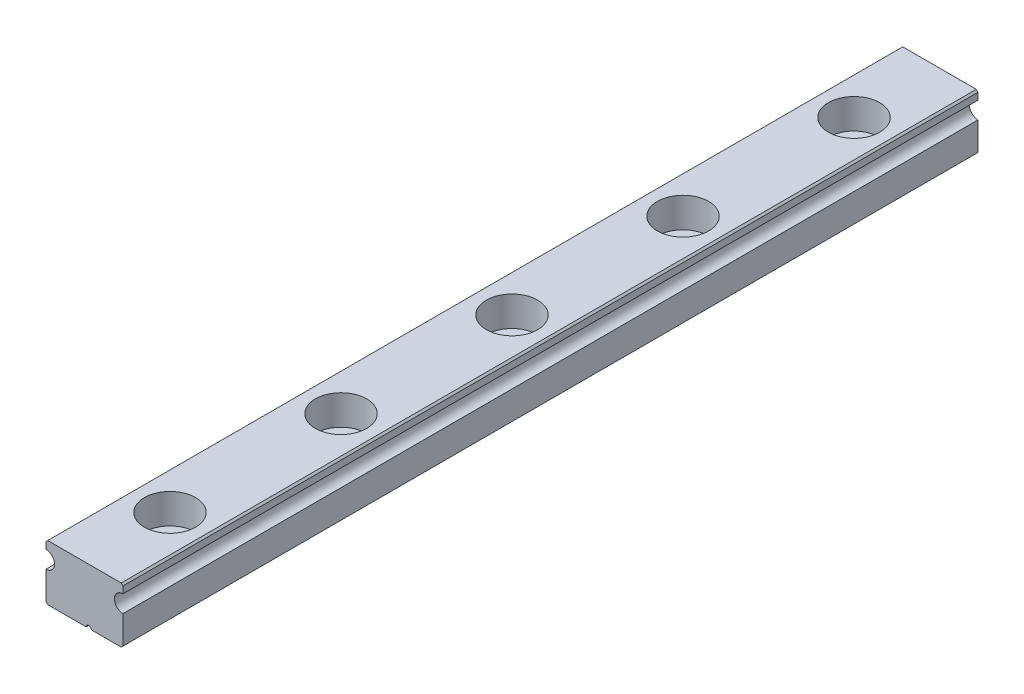
from build123d import *

# Parameters (mm, degrees)
EXTRUDE_1_DEPTH              = 220
HOLE_WIZARD_M3_1_D           = 3.5
HOLE_WIZARD_M3_1_CBORE_D     = 6
HOLE_WIZARD_M3_1_CBORE_DEPTH = 3.5
PATTERN_LINEAR_1_COUNT       = 11
PATTERN_LINEAR_1_PITCH       = 20
SKETCH_6_W                   = 1.5
SKETCH_6_H                   = 0.134615385
CUT_EXTRUDE_1_DEPTH          = 0.1
SKETCH_8_W                   = 50
SKETCH_8_H                   = 60
SKETCH_8_H_2                 = 140
CUT_EXTRUDE_2_DEPTH          = 221.14199973


with BuildPart() as part:
    # 草图1 → 凸台-拉伸1 (new body)
    with BuildSketch(Plane.XY):
        with BuildLine():
            Line((4.5, 5.5), (4.5, 6.3))
            Line((4.5, 6.3), (4.3, 6.5))
            Line((4.3, 6.5), (-4.3, 6.5))
            Line((-4.3, 6.5), (-4.5, 6.3))
            Line((-4.5, 6.3), (-4.5, 5.5))
            ThreePointArc((-4.5, 5.5), (-3.5, 4.5), (-4.5, 3.5))
            Line((-4.5, 3.5), (-4.5, 0.2))
            Line((-4.5, 0.2), (-4.3, 0))
            Line((-4.3, 0), (0.2, 0))
            ThreePointArc((0.2, 0), (0.5, 0.3), (0.8, 0))
            Line((0.8, 0), (4.3, 0))
            Line((4.3, 0), (4.5, 0.2))
            Line((4.5, 0.2), (4.5, 3.5))
            ThreePointArc((4.5, 3.5), (3.5, 4.5), (4.5, 5.5))
        make_face()
    extrude(amount=-EXTRUDE_1_DEPTH)

    # M3 六角凹头螺钉的柱形沉头孔1 (through all)
    with Locations(Plane(origin=(0.754900713, 6.5, 19.343475793), x_dir=(-1, 0, 0), z_dir=(0, 1, 0))):
        with Locations((0.754900713, -29.343475793)):
            hole_wizard_m3_1 = CounterBoreHole(HOLE_WIZARD_M3_1_D / 2, HOLE_WIZARD_M3_1_CBORE_D / 2, HOLE_WIZARD_M3_1_CBORE_DEPTH)

    # 阵列(线性)1: M3 六角凹头螺钉的柱形沉头孔1 ×11
    with Locations(*[(0, 0, -i * PATTERN_LINEAR_1_PITCH) for i in range(1, PATTERN_LINEAR_1_COUNT)]):
        add(hole_wizard_m3_1, mode=Mode.SUBTRACT)

    # 草图6 → 切除-拉伸1 (cut)
    # profile 1 of 9: a face of its own
    with BuildSketch(Plane(origin=(0, 6.5, 0), x_dir=(1, 0, 0), z_dir=(0, 1, 0))):
        Polygon((-1.5, 13.740384615), (-1.5, 13.875), (-0.884615385, 13.875), (-0.884615385, 14.644230769), (-1.5, 14.644230769), (-1.5, 14.778846154), (0, 14.778846154), (0, 14.644230769), (-0.730769231, 14.644230769), (-0.730769231, 13.875), (0, 13.875), (0, 13.740384615), align=None)
    # profile 2 of 9: a face of its own
    with BuildSketch(Plane(origin=(0, 6.5, 0), x_dir=(1, 0, 0), z_dir=(0, 1, 0))):
        with Locations((-0.75, 15.230769231)):
            Rectangle(SKETCH_6_W, SKETCH_6_H)
    # profile 3 of 9: a face of its own
    with BuildSketch(Plane(origin=(0, 6.5, 0), x_dir=(1, 0, 0), z_dir=(0, 1, 0))):
        Polygon((-1.5, 15.528846154), (-1.5, 15.66796875), (-0.399939904, 15.961538462), (-1.5, 16.398137019), (-1.5, 16.417668269), (-0.407451923, 16.846153846), (-1.5, 17.141225962), (-1.5, 17.278846154), (0, 16.874399038), (0, 16.855168269), (-1.147235577, 16.403846154), (0, 15.947115385), (0, 15.927884615), align=None)
    # profile 4 of 9: a face of its own
    with BuildSketch(Plane(origin=(0, 6.5, 0), x_dir=(1, 0, 0), z_dir=(0, 1, 0))):
        with Locations((-0.75, 17.692307693)):
            Rectangle(SKETCH_6_W, SKETCH_6_H)
    # profile 5 of 9: a face of its own
    with BuildSketch(Plane(origin=(0, 6.5, 0), x_dir=(1, 0, 0), z_dir=(0, 1, 0))):
        Polygon((0, 18.086538462), (-1.5, 18.086538462), (-1.5, 18.114783654), (-0.319411058, 19.105769231), (-1.5, 19.105769231), (-1.5, 19.240384615), (0, 19.240384615), (0, 19.209735577), (-1.177884615, 18.221153846), (0, 18.221153846), align=None)
    # profile 6 of 9: a face of its own
    with BuildSketch(Plane(origin=(0, 6.5, 0), x_dir=(1, 0, 0), z_dir=(0, 1, 0))):
        Polygon((0, 20.125), (-1.5, 20.323016827), (-1.5, 20.342247596), (-0.269230769, 20.961538462), (-1.5, 21.579326923), (-1.5, 21.598858173), (0, 21.798076923), (0, 21.662860577), (-1.079326923, 21.519230769), (0, 20.977764423), (0, 20.947415865), (-1.081730769, 20.403846154), (0, 20.260516827), align=None)
    # profile 7 of 9: a face of its own
    with BuildSketch(Plane(origin=(0, 6.5, 0), x_dir=(1, 0, 0), z_dir=(0, 1, 0))):
        with BuildLine():
            Line((-1.243990385, 23.509615385), (-1.134615385, 23.394230769))
            add(Edge.make_bspline(
                [(-1.134615385, 23.394230769), (-1.154263766, 23.373355449), (-1.193092001, 23.332102593), (-1.243390317, 23.264731189), (-1.28690443, 23.194721537), (-1.322045397, 23.121960438), (-1.349611823, 23.048355866), (-1.369650093, 22.975173457), (-1.382340162, 22.902887044), (-1.383864341, 22.854816629), (-1.384615385, 22.831129808)],
                knots=[0, 0, 0, 0, 1.089067066, 2.152164705, 3.18986567, 4.218445106, 5.218487318, 6.173592265, 7.100032889, 8, 8, 8, 8], degree=3))
            add(Edge.make_bspline(
                [(-1.384615385, 22.831129808), (-1.384438125, 22.816594936), (-1.384084065, 22.78756289), (-1.379565116, 22.7444392), (-1.373065889, 22.701767784), (-1.363662227, 22.659629195), (-1.351744059, 22.6179415), (-1.336836002, 22.576849691), (-1.319455188, 22.536277104), (-1.299371251, 22.496605953), (-1.277308532, 22.458145638), (-1.252858892, 22.42182164), (-1.226807524, 22.387400299), (-1.198496406, 22.355536353), (-1.168203133, 22.326017847), (-1.136473262, 22.298301833), (-1.102682945, 22.272904871), (-1.066971137, 22.250282454), (-1.030168657, 22.229853485), (-0.992587626, 22.212199685), (-0.954576919, 22.196852561), (-0.915850319, 22.185163721), (-0.876807084, 22.175263346), (-0.837242608, 22.168371388), (-0.797053572, 22.164472967), (-0.770140273, 22.163799899), (-0.756610577, 22.163461538)],
                knots=[0, 0, 0, 0, 1.028150113, 2.053633673, 3.06513288, 4.081487945, 5.106702018, 6.131327874, 7.172780699, 8.228344599, 9.276313556, 10.308389736, 11.324843658, 12.329040066, 13.321460474, 14.316307835, 15.308626991, 16.309440696, 17.305625405, 18.28535951, 19.246194545, 20.203493668, 21.145557131, 22.095268976, 23.042464743, 24, 24, 24, 24], degree=3))
            add(Edge.make_bspline(
                [(-0.756610577, 22.163461538), (-0.742780294, 22.163785622), (-0.715157493, 22.164432905), (-0.673930463, 22.168569989), (-0.633320499, 22.176265079), (-0.593263727, 22.186470115), (-0.553680426, 22.199444118), (-0.514611904, 22.215383767), (-0.476061961, 22.23437211), (-0.438413282, 22.256302653), (-0.401770368, 22.280520997), (-0.36696502, 22.307157219), (-0.334402283, 22.336256163), (-0.303606537, 22.367284281), (-0.274772132, 22.40052428), (-0.248246624, 22.43629865), (-0.223619847, 22.474106619), (-0.201162346, 22.513964957), (-0.181102046, 22.555452377), (-0.163263098, 22.597990847), (-0.14857199, 22.641717091), (-0.136598507, 22.686401091), (-0.126784097, 22.731989638), (-0.120470176, 22.778714125), (-0.115888391, 22.826231), (-0.11555339, 22.858261842), (-0.115384615, 22.874399038)],
                knots=[0, 0, 0, 0, 0.935915162, 1.869274651, 2.799799983, 3.730201895, 4.664668062, 5.616159355, 6.583070886, 7.570012957, 8.562524459, 9.553461134, 10.53281078, 11.515274572, 12.509912756, 13.507571325, 14.526460018, 15.561318395, 16.601025881, 17.643204557, 18.680545676, 19.719612342, 20.772381578, 21.833430283, 22.908478249, 24, 24, 24, 24], degree=3))
            add(Edge.make_bspline(
                [(-0.115384615, 22.874399038), (-0.11579098, 22.893846981), (-0.116588941, 22.932036175), (-0.122805743, 22.988172098), (-0.132502802, 23.042091792), (-0.14674811, 23.093619722), (-0.164779159, 23.142942891), (-0.187077122, 23.189879386), (-0.213407387, 23.234558812), (-0.24323677, 23.276787781), (-0.276471827, 23.315562361), (-0.312015273, 23.350851823), (-0.350327601, 23.381442662), (-0.390837822, 23.408248655), (-0.433933425, 23.430404616), (-0.479374666, 23.448595707), (-0.527189663, 23.462538188), (-0.560228886, 23.468261798), (-0.576923077, 23.471153846)],
                knots=[0, 0, 0, 0, 1.130199668, 2.219330667, 3.279027493, 4.311506524, 5.322739849, 6.327972234, 7.327472899, 8.33386792, 9.329086447, 10.29244429, 11.240784345, 12.174119183, 13.111530729, 14.052100829, 15.015757696, 16, 16, 16, 16], degree=3))
            Line((-0.576923077, 23.471153846), (-0.576923077, 22.971153846))
            Line((-0.576923077, 22.971153846), (-0.730769231, 22.971153846))
            Line((-0.730769231, 22.971153846), (-0.730769231, 23.605769231))
            add(Edge.make_bspline(
                [(-0.730769231, 23.605769231), (-0.702094593, 23.605038153), (-0.645973146, 23.603607301), (-0.564128744, 23.593570623), (-0.48682659, 23.577363547), (-0.413985274, 23.555223413), (-0.34570802, 23.526562579), (-0.281925506, 23.491688638), (-0.223049785, 23.450043443), (-0.168600212, 23.403110397), (-0.12003055, 23.350438986), (-0.077342291, 23.293452435), (-0.041384027, 23.232056591), (-0.012129457, 23.166309531), (0.010702255, 23.096426488), (0.026890073, 23.022245754), (0.036588629, 22.943867925), (0.037827792, 22.890152206), (0.038461538, 22.862680288)],
                knots=[0, 0, 0, 0, 1.140356446, 2.231883559, 3.274166699, 4.278491846, 5.25512956, 6.21435461, 7.1637429, 8.11826594, 9.068280886, 10.0076534, 10.945064095, 11.891975133, 12.864533718, 13.863980011, 14.907571808, 16, 16, 16, 16], degree=3))
            add(Edge.make_bspline(
                [(0.038461538, 22.862680288), (0.038217629, 22.845747373), (0.037736562, 22.812350207), (0.034317699, 22.763025524), (0.029054595, 22.715060829), (0.021106685, 22.668463111), (0.011371833, 22.623060964), (-0.001093904, 22.579081142), (-0.015523346, 22.53635611), (-0.031935778, 22.494819831), (-0.050952202, 22.45484931), (-0.072084905, 22.416266517), (-0.095224917, 22.378858178), (-0.120772422, 22.342879107), (-0.148536333, 22.308141841), (-0.178572299, 22.274870365), (-0.210788493, 22.242878417), (-0.233665211, 22.222838219), (-0.245192308, 22.212740385)],
                knots=[0, 0, 0, 0, 1.107784379, 2.184907829, 3.233506516, 4.263428166, 5.276301166, 6.270063455, 7.25232949, 8.225834625, 9.190232166, 10.146266622, 11.1027726, 12.066435141, 13.031522626, 14.010570082, 14.99756817, 16, 16, 16, 16], degree=3))
            add(Edge.make_bspline(
                [(-0.245192308, 22.212740385), (-0.26347973, 22.198089271), (-0.299751023, 22.169030237), (-0.357865285, 22.131625313), (-0.418037511, 22.099738997), (-0.480435209, 22.073867073), (-0.545000015, 22.053665036), (-0.611649425, 22.039176642), (-0.680469267, 22.030687804), (-0.727040094, 22.02946486), (-0.750600962, 22.028846154)],
                knots=[0, 0, 0, 0, 1.023165419, 2.029347347, 3.013907458, 3.994755782, 4.975994455, 5.96558838, 6.970761222, 8, 8, 8, 8], degree=3))
            add(Edge.make_bspline(
                [(-0.750600962, 22.028846154), (-0.768243641, 22.029074256), (-0.803304773, 22.029527561), (-0.855357904, 22.035024211), (-0.906486775, 22.042910531), (-0.956649576, 22.054502135), (-1.005879862, 22.069114786), (-1.054200296, 22.087352121), (-1.101640133, 22.108585168), (-1.147870041, 22.133266476), (-1.192287019, 22.160724506), (-1.234673706, 22.190556358), (-1.274343142, 22.222992223), (-1.311387223, 22.258126549), (-1.346354989, 22.295251091), (-1.378516018, 22.33514522), (-1.408373576, 22.377204507), (-1.435353952, 22.421754996), (-1.459597318, 22.468093695), (-1.480849352, 22.516119874), (-1.498413761, 22.565816082), (-1.513316774, 22.616810749), (-1.524337558, 22.669489669), (-1.532329875, 22.723470616), (-1.537798704, 22.779034949), (-1.538238528, 22.816593247), (-1.538461538, 22.835637019)],
                knots=[0, 0, 0, 0, 1.00895651, 2.005089799, 2.991467152, 3.967318338, 4.948153826, 5.927364234, 6.919980553, 7.91976625, 8.923240147, 9.905815003, 10.88314567, 11.851989312, 12.825009789, 13.798721852, 14.781296708, 15.773896486, 16.776076962, 17.771600213, 18.775744723, 19.78957137, 20.808953803, 21.851964491, 22.910847925, 24, 24, 24, 24], degree=3))
            add(Edge.make_bspline(
                [(-1.538461538, 22.835637019), (-1.538213185, 22.851167695), (-1.537720729, 22.8819632), (-1.534307308, 22.927788514), (-1.528897073, 22.97290552), (-1.521514165, 23.017381116), (-1.511458298, 23.061063844), (-1.499424747, 23.104078147), (-1.485413966, 23.146486377), (-1.46870446, 23.188155626), (-1.449738621, 23.229366076), (-1.428390011, 23.270346865), (-1.404293581, 23.31095797), (-1.37737778, 23.351269819), (-1.348104887, 23.391536616), (-1.315637676, 23.431121462), (-1.281256495, 23.470979867), (-1.256535559, 23.496609216), (-1.243990385, 23.509615385)],
                knots=[0, 0, 0, 0, 0.985871117, 1.954866573, 2.915460327, 3.869826059, 4.81536089, 5.759505086, 6.70452669, 7.649098992, 8.607881297, 9.583363685, 10.581137262, 11.603961102, 12.659522466, 13.73993555, 14.853081303, 16, 16, 16, 16], degree=3))
        make_face()
    # profile 8 of 9: a face of its own
    with BuildSketch(Plane(origin=(0, 6.5, 0), x_dir=(1, 0, 0), z_dir=(0, 1, 0))):
        Polygon((0, 23.913461538), (-1.5, 23.913461538), (-1.5, 23.941706731), (-0.319411058, 24.932692308), (-1.5, 24.932692308), (-1.5, 25.067307692), (0, 25.067307692), (0, 25.036658654), (-1.177884615, 24.048076923), (0, 24.048076923), align=None)
    # profile 9 of 9: a face of its own
    with BuildSketch(Plane(origin=(0, 6.5, 0), x_dir=(1, 0, 0), z_dir=(0, 1, 0))):
        with BuildLine():
            Line((0.038461538, 25.644230769), (-0.036358173, 25.536658654))
            Line((-0.036358173, 25.536658654), (-0.646033654, 25.953725962))
            add(Edge.make_bspline(
                [(-0.646033654, 25.953725962), (-0.642627639, 25.927119325), (-0.635922786, 25.874743285), (-0.635046516, 25.821948826), (-0.634615385, 25.795973558)],
                knots=[0, 0, 0, 0, 1.015985029, 2, 2, 2, 2], degree=3))
            add(Edge.make_bspline(
                [(-0.634615385, 25.795973558), (-0.635018703, 25.780226966), (-0.635810382, 25.749317783), (-0.642085443, 25.703875646), (-0.651749784, 25.660210407), (-0.666170676, 25.61843782), (-0.684092777, 25.578400913), (-0.706317169, 25.540186946), (-0.732462883, 25.503847908), (-0.762390698, 25.469771994), (-0.79525498, 25.438786105), (-0.830027824, 25.411158608), (-0.867084601, 25.38832306), (-0.905643777, 25.369014905), (-0.946528356, 25.354782526), (-0.989044603, 25.344167996), (-1.033456433, 25.33770465), (-1.063680548, 25.336931181), (-1.079026442, 25.336538462)],
                knots=[0, 0, 0, 0, 1.060698949, 2.082059282, 3.085738422, 4.069684654, 5.054463875, 6.037298355, 7.043153692, 8.066652628, 9.088369706, 10.083456696, 11.053578809, 12.016466116, 12.983507685, 13.964045196, 14.966270913, 16, 16, 16, 16], degree=3))
            add(Edge.make_bspline(
                [(-1.079026442, 25.336538462), (-1.100012199, 25.337283285), (-1.141202981, 25.338745222), (-1.201400397, 25.350466182), (-1.258351131, 25.369885651), (-1.3119915, 25.396537862), (-1.361089385, 25.43075081), (-1.405478439, 25.47138122), (-1.444366827, 25.518757479), (-1.477757084, 25.571642671), (-1.504794475, 25.628718475), (-1.524003389, 25.688742519), (-1.536274492, 25.750703662), (-1.537729379, 25.792811829), (-1.538461538, 25.814002404)],
                knots=[0, 0, 0, 0, 1.023011052, 2.007963168, 2.978169221, 3.950402619, 4.919353283, 5.887490769, 6.876420893, 7.899700203, 8.931203047, 9.947778163, 10.96723692, 12, 12, 12, 12], degree=3))
            add(Edge.make_bspline(
                [(-1.538461538, 25.814002404), (-1.537677179, 25.834783148), (-1.536127357, 25.875843941), (-1.524777147, 25.936225043), (-1.505646911, 25.994056533), (-1.479211547, 26.04902008), (-1.446070758, 26.099903164), (-1.406596454, 26.145683388), (-1.360755672, 26.185145911), (-1.309807647, 26.21879079), (-1.25472961, 26.245295182), (-1.197347446, 26.264716171), (-1.138006313, 26.276587527), (-1.097810064, 26.2780886), (-1.077524038, 26.278846154)],
                knots=[0, 0, 0, 0, 1.026358223, 2.027987109, 3.023239252, 4.028077889, 5.032770297, 6.015020143, 7.004250571, 8.011656937, 9.02310243, 10.015224881, 10.998334443, 12, 12, 12, 12], degree=3))
            add(Edge.make_bspline(
                [(-1.077524038, 26.278846154), (-1.061777289, 26.278338872), (-1.029838946, 26.277309978), (-0.981399024, 26.270187018), (-0.932048608, 26.257900384), (-0.890237555, 26.244171772), (-0.855599349, 26.230715419), (-0.828157364, 26.218414328), (-0.799474135, 26.204124912), (-0.769432207, 26.188166246), (-0.737992383, 26.170568563), (-0.705372722, 26.150853478), (-0.671525668, 26.129286907), (-0.648704972, 26.113932306), (-0.637019231, 26.106069712)],
                knots=[0, 0, 0, 0, 1.179894106, 2.393120058, 3.660107319, 4.986885617, 5.687958251, 6.443931318, 7.239444731, 8.088894906, 8.992865148, 9.938946712, 10.944601238, 12, 12, 12, 12], degree=3))
            Line((-0.637019231, 26.106069712), (0.038461538, 25.644230769))
        make_face()
        with BuildLine():
            add(Edge.make_bspline(
                [(-0.788461538, 25.820913462), (-0.788788092, 25.832842038), (-0.789423782, 25.856062922), (-0.793275522, 25.890085737), (-0.800155229, 25.922181807), (-0.809870336, 25.952557703), (-0.822177437, 25.981176653), (-0.837175655, 26.008047671), (-0.855193568, 26.032896281), (-0.875446063, 26.05581095), (-0.897641992, 26.076606708), (-0.92142287, 26.094537445), (-0.946049906, 26.110062218), (-0.972027251, 26.122447516), (-0.998929945, 26.132428799), (-1.027147055, 26.139393389), (-1.056483756, 26.143240028), (-1.076411522, 26.143896939), (-1.086538462, 26.144230769)],
                knots=[0, 0, 0, 0, 1.163726718, 2.265380301, 3.334713825, 4.36057981, 5.371541381, 6.368955992, 7.355979581, 8.359691305, 9.348261197, 10.317521986, 11.261029684, 12.183096459, 13.119698615, 14.055740009, 15.011961376, 16, 16, 16, 16], degree=3))
            add(Edge.make_bspline(
                [(-1.086538462, 26.144230769), (-1.096669885, 26.143944046), (-1.116635099, 26.143379024), (-1.146011565, 26.138837612), (-1.174173238, 26.130870253), (-1.201311834, 26.120071794), (-1.227278993, 26.10611642), (-1.252156559, 26.089207568), (-1.27556797, 26.06878977), (-1.297899065, 26.04597379), (-1.318157147, 26.020878942), (-1.336055672, 25.994290795), (-1.351161049, 25.966351386), (-1.363089133, 25.93693608), (-1.37286104, 25.906444325), (-1.379778661, 25.87456046), (-1.383632614, 25.841240421), (-1.384283622, 25.818619358), (-1.384615385, 25.807091346)],
                knots=[0, 0, 0, 0, 0.971910406, 1.91526867, 2.84337505, 3.775008003, 4.712374136, 5.666733183, 6.654995996, 7.688089235, 8.726800303, 9.745078658, 10.75990398, 11.768337501, 12.786615857, 13.829099629, 14.893678693, 16, 16, 16, 16], degree=3))
            add(Edge.make_bspline(
                [(-1.384615385, 25.807091346), (-1.384283077, 25.795663594), (-1.383631091, 25.773242439), (-1.379786064, 25.740218598), (-1.372814047, 25.708550372), (-1.363093561, 25.678147127), (-1.351160136, 25.648732673), (-1.336054875, 25.620794582), (-1.318161301, 25.594200241), (-1.297882935, 25.569129265), (-1.275672102, 25.546272163), (-1.252051947, 25.526199864), (-1.227292163, 25.509252774), (-1.201308356, 25.495316895), (-1.174174163, 25.48451328), (-1.146011315, 25.476547297), (-1.116635164, 25.472005515), (-1.096669907, 25.471440543), (-1.086538462, 25.471153846)],
                knots=[0, 0, 0, 0, 1.099107991, 2.156440826, 3.191784126, 4.212280276, 5.222910149, 6.239945746, 7.260441896, 8.30141526, 9.33675856, 10.320924759, 11.277362386, 12.216770088, 13.150432123, 14.080559904, 15.025972789, 16, 16, 16, 16], degree=3))
            add(Edge.make_bspline(
                [(-1.086538462, 25.471153846), (-1.076403667, 25.471413811), (-1.056415996, 25.471926509), (-1.02704542, 25.476862927), (-0.998901248, 25.485140198), (-0.971743232, 25.496115903), (-0.945922725, 25.510845615), (-0.921305837, 25.528746476), (-0.897389308, 25.549401013), (-0.875515463, 25.573486122), (-0.855096635, 25.599349364), (-0.837288944, 25.627129241), (-0.822356647, 25.656267501), (-0.809834058, 25.686577057), (-0.800253227, 25.718284705), (-0.793288301, 25.751346293), (-0.789460709, 25.785767775), (-0.788797791, 25.809085836), (-0.788461538, 25.820913462)],
                knots=[0, 0, 0, 0, 0.952872936, 1.879239831, 2.791748947, 3.708674669, 4.628500839, 5.580394867, 6.568761142, 7.595635223, 8.636123962, 9.665976811, 10.694276597, 11.712685318, 12.747011694, 13.805940053, 14.887106426, 16, 16, 16, 16], degree=3))
        make_face(mode=Mode.SUBTRACT)
    extrude(amount=-CUT_EXTRUDE_1_DEPTH, mode=Mode.SUBTRACT)

    # 草图8 → 切除-拉伸2 (cut, through all)
    with BuildSketch(Plane(origin=(0, 6.5, 0), x_dir=(1, 0, 0), z_dir=(0, 1, 0))):
        with Locations((0, 210)):
            Rectangle(SKETCH_8_W, SKETCH_8_H)
        with Locations((0, 10)):
            Rectangle(SKETCH_8_W, SKETCH_8_H_2)
    extrude(amount=-CUT_EXTRUDE_2_DEPTH, mode=Mode.SUBTRACT)


solid = part.part
